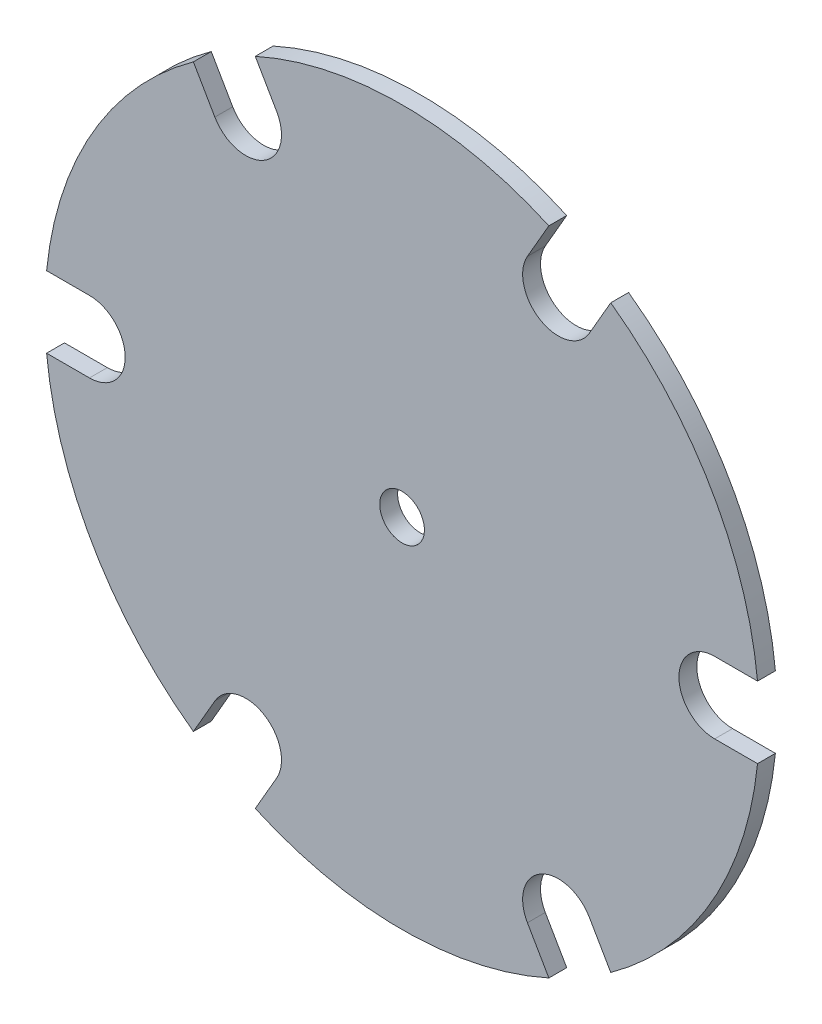
from build123d import *

# Parameters (mm, degrees)
SKETCH_1_R      = 2.5
EXTRUDE_1_DEPTH = 2


with BuildPart() as part:
    # 草图1 → 凸台-拉伸1 (new body)
    with BuildSketch(Plane.XY):
        with BuildLine():
            Line((-35, 4), (-39.799497484, 4))
            ThreePointArc((-39.799497484, 4), (-34.641016151, 20), (-23.363850357, 32.467375879))
            Line((-23.363850357, 32.467375879), (-20.964101615, 28.310889132))
            ThreePointArc((-20.964101615, 28.310889132), (-15.5, 26.846787517), (-14.035898385, 32.310889132))
            Line((-14.035898385, 32.310889132), (-16.435647127, 36.467375879))
            ThreePointArc((-16.435647127, 36.467375879), (0, 40), (16.435647127, 36.467375879))
            Line((16.435647127, 36.467375879), (14.035898385, 32.310889132))
            ThreePointArc((14.035898385, 32.310889132), (15.5, 26.846787517), (20.964101615, 28.310889132))
            Line((20.964101615, 28.310889132), (23.363850357, 32.467375879))
            ThreePointArc((23.363850357, 32.467375879), (34.641016151, 20), (39.799497484, 4))
            Line((39.799497484, 4), (35, 4))
            ThreePointArc((35, 4), (31, 0), (35, -4))
            Line((35, -4), (39.799497484, -4))
            ThreePointArc((39.799497484, -4), (34.641016151, -20), (23.363850357, -32.467375879))
            Line((23.363850357, -32.467375879), (20.964101615, -28.310889132))
            ThreePointArc((20.964101615, -28.310889132), (15.5, -26.846787517), (14.035898385, -32.310889132))
            Line((14.035898385, -32.310889132), (16.435647127, -36.467375879))
            ThreePointArc((16.435647127, -36.467375879), (0, -40), (-16.435647127, -36.467375879))
            Line((-16.435647127, -36.467375879), (-14.035898385, -32.310889132))
            ThreePointArc((-14.035898385, -32.310889132), (-15.5, -26.846787517), (-20.964101615, -28.310889132))
            Line((-20.964101615, -28.310889132), (-23.363850357, -32.467375879))
            ThreePointArc((-23.363850357, -32.467375879), (-34.641016151, -20), (-39.799497484, -4))
            Line((-39.799497484, -4), (-35, -4))
            ThreePointArc((-35, -4), (-31, 0), (-35, 4))
        make_face()
        Circle(SKETCH_1_R, mode=Mode.SUBTRACT)
    extrude(amount=EXTRUDE_1_DEPTH)


solid = part.part
